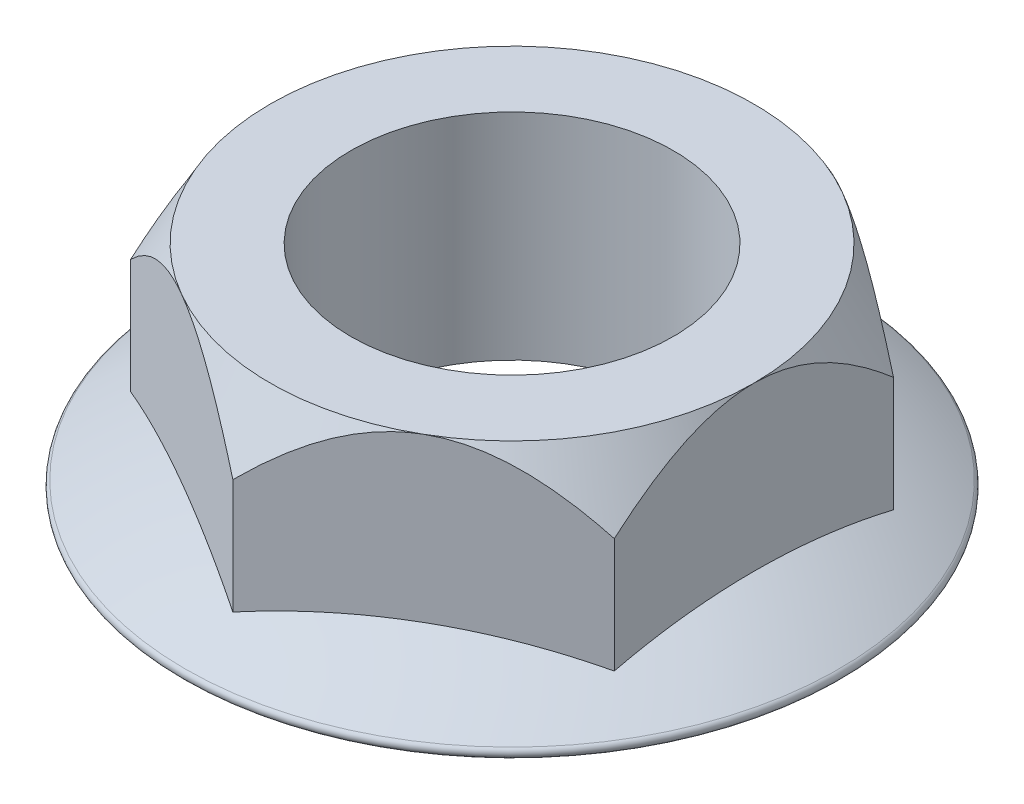
from build123d import *

# Parameters (mm, degrees)
SKETCH1_R           = 15
BOSS_EXTRUDE1_DEPTH = 20
SKETCH2_OUTSIDE_W   = 104.228
SKETCH2_OUTSIDE_H   = 104.228
SKETCH2_OUTSIDE_R   = 22.5
CUT_EXTRUDE1_DEPTH  = 20
CUT_EXTRUDE1_DRAFT  = -30
CUT_EXTRUDE2_REACH  = 49.758
SKETCH4_R           = 15


with BuildPart() as part:
    # Sketch1 → Boss-Extrude1 (new body)
    with BuildSketch(Plane(origin=(0, 0, 0), x_dir=(1, 0, 0), z_dir=(0, 1, 0))):
        Polygon((0, 25.980762114), (-22.5, 12.990381057), (-22.5, -12.990381057), (0, -25.980762114), (22.5, -12.990381057), (22.5, 12.990381057), align=None)
        with Locations(Location((0, 0, 0), (0, 0, 270))):
            Circle(SKETCH1_R, mode=Mode.SUBTRACT)
    extrude(amount=BOSS_EXTRUDE1_DEPTH)

    # Sketch3 → Revolve1 (revolve)
    with BuildSketch(Plane.XY, mode=Mode.PRIVATE) as revolve1_sk:
        with BuildLine():
            Line((0, 9.214199819), (0, 0))
            Line((0, 0), (30.166483054, 0))
            ThreePointArc((30.166483054, 0), (30.648917793, 0.368635156), (30.419982911, 0.930973111))
            ThreePointArc((30.419982911, 0.930973111), (15.763781312, 7.106368536), (0, 9.214199819))
        make_face()
    revolve(revolve1_sk.sketch.rotate(Axis((0, 0, 0), (0, -1, 0)), 90), axis=Axis((0, 0, 0), (0, -1, 0)))


with BuildPart() as cut_extrude1_tool:
    # Sketch2 outside → Cut-Extrude1 (with draft: the straight prism first)
    with BuildSketch(Plane(origin=(0, 20, 0), x_dir=(1, 0, 0), z_dir=(0, 1, 0))):
        Rectangle(SKETCH2_OUTSIDE_W, SKETCH2_OUTSIDE_H)
        Circle(SKETCH2_OUTSIDE_R, mode=Mode.SUBTRACT)
    extrude(amount=-CUT_EXTRUDE1_DEPTH)
    # Cut-Extrude1: the draft: its side faces are tilted about the plane it starts from
    cut_extrude1_sides = [cut_extrude1_tool.faces().sort_by_distance(p)[0] for p in [
        (0, 10, 52.114),
        (52.114, 10, 0),
        (0, 10, -52.114),
        (-52.114, 10, 0),
        (-22.5, 10, 0),
    ]]
    draft(cut_extrude1_sides, Plane(origin=(0, 20, 0), x_dir=(1, 0, 0), z_dir=(0, 1, 0)), CUT_EXTRUDE1_DRAFT)


with BuildPart() as part_1:
    add(part.part)

    # Cut-Extrude1: cut by cut_extrude1_tool
    add(cut_extrude1_tool.part, mode=Mode.SUBTRACT)

    # Sketch4 → Cut-Extrude2 (cut, up to next)
    with BuildSketch(Plane(origin=(0, 20, 0), x_dir=(1, 0, 0), z_dir=(0, 1, 0)), mode=Mode.PRIVATE) as cut_extrude2_sk1:
        with Locations(Location((0, 0, 0), (0, 0, 270))):
            Circle(SKETCH4_R)
    cut_extrude2_tool1 = extrude(cut_extrude2_sk1.sketch, amount=-CUT_EXTRUDE2_REACH, mode=Mode.PRIVATE) & part_1.part
    add(cut_extrude2_tool1.solids().sort_by_distance((0, 20, 0))[0], mode=Mode.SUBTRACT)


solid = part_1.part
